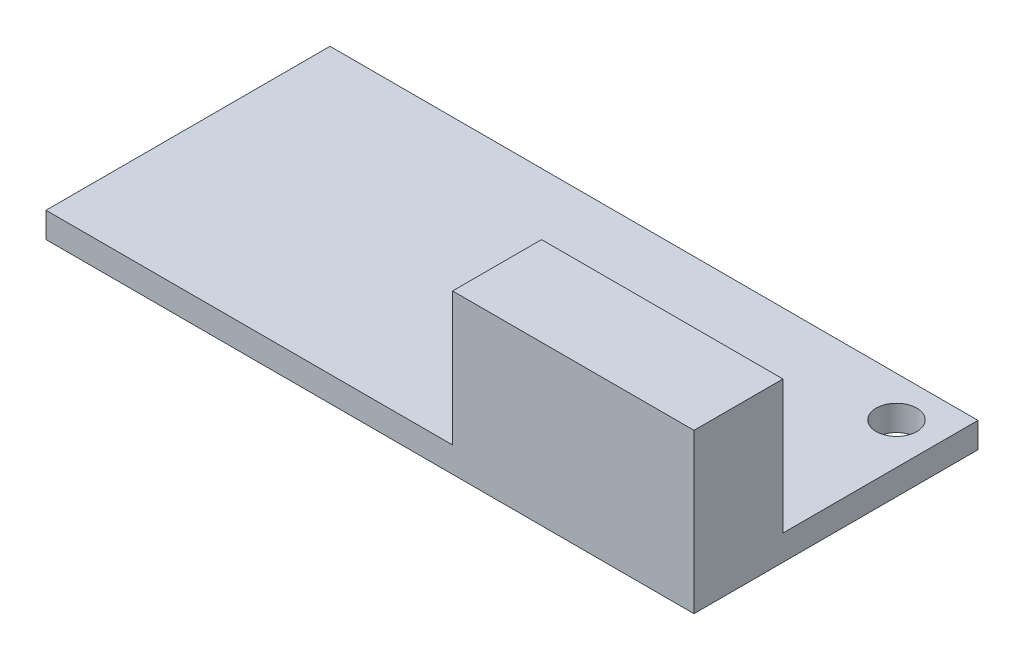
from build123d import *

# Parameters (mm, degrees)
SKETCH1_W           = 51
SKETCH1_H           = 22.352
SKETCH1_R           = 1.6
BOSS_EXTRUDE1_DEPTH = 2
SKETCH2_W           = 19
SKETCH2_H           = 7
BOSS_EXTRUDE2_DEPTH = 10.5
SKETCH3_W           = 43.18
SKETCH3_H           = 7.62
BOSS_EXTRUDE3_DEPTH = 4.5


with BuildPart() as part:
    # Sketch1 → Boss-Extrude1 (new body)
    with BuildSketch(Plane(origin=(0, 0, 0), x_dir=(1, 0, 0), z_dir=(0, 1, 0))):
        Rectangle(SKETCH1_W, SKETCH1_H)
        with Locations(Location((22.252, 8.005562403, 0), (0, 0, 270))):
            Circle(SKETCH1_R, mode=Mode.SUBTRACT)
    extrude(amount=BOSS_EXTRUDE1_DEPTH)

    # Sketch2 → Boss-Extrude2 (add)
    with BuildSketch(Plane(origin=(0, 2, 0), x_dir=(1, 0, 0), z_dir=(0, 1, 0))):
        with Locations((16, -7.676)):
            Rectangle(SKETCH2_W, SKETCH2_H)
    extrude(amount=BOSS_EXTRUDE2_DEPTH)

    # Sketch3 → Boss-Extrude3 (add)
    with BuildSketch(Plane.XZ):
        with Locations((-3.91, -7.366)):
            Rectangle(SKETCH3_W, SKETCH3_H)
    extrude(amount=BOSS_EXTRUDE3_DEPTH)


solid = part.part
